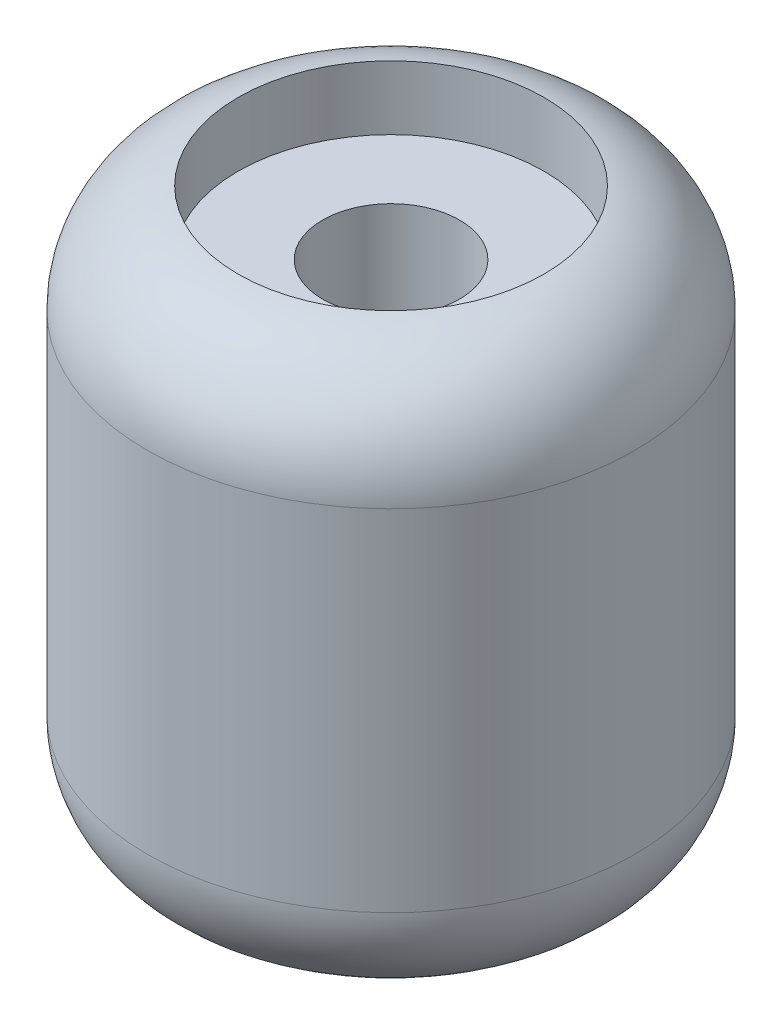
from build123d import *

# Parameters (mm, degrees)
CORTAR_EXTRUIR1_START = -13
CROQUIS3_R            = 7
CROQUIS3_R_2          = 3.134205676
CORTAR_EXTRUIR1_DEPTH = 13


with BuildPart() as part:
    # Croquis1 → Revolución1 (revolve)
    with BuildSketch(Plane.XY, mode=Mode.PRIVATE) as revoluci_n1_sk:
        with BuildLine():
            Line((-3.134205676, -13), (-6.134205676, -13))
            ThreePointArc((-6.134205676, -13), (-9.669739582, -11.535533906), (-11.134205676, -8))
            Line((-11.134205676, -8), (-11.134205676, 8))
            ThreePointArc((-11.134205676, 8), (-9.669739582, 11.535533906), (-6.134205676, 13))
            Line((-6.134205676, 13), (-3.134205676, 13))
            Line((-3.134205676, 13), (-3.134205676, -13))
        make_face()
    revolve(revoluci_n1_sk.sketch.rotate(Axis((0, 13, 0), (0, -1, 0)), 270), axis=Axis((0, 13, 0), (0, -1, 0)))

    # Croquis3 → Cortar-Extruir1 (cut)
    with BuildSketch(Plane(origin=(0, 23, 0), x_dir=(1, 0, 0), z_dir=(0, 1, 0)).offset(CORTAR_EXTRUIR1_START)):
        with Locations(Location((0, 0, 0), (0, 0, 270))):
            Circle(CROQUIS3_R)
        with Locations(Location((0, 0, 0), (0, 0, 270))):
            Circle(CROQUIS3_R_2, mode=Mode.SUBTRACT)
    extrude(amount=CORTAR_EXTRUIR1_DEPTH, mode=Mode.SUBTRACT)


solid = part.part
